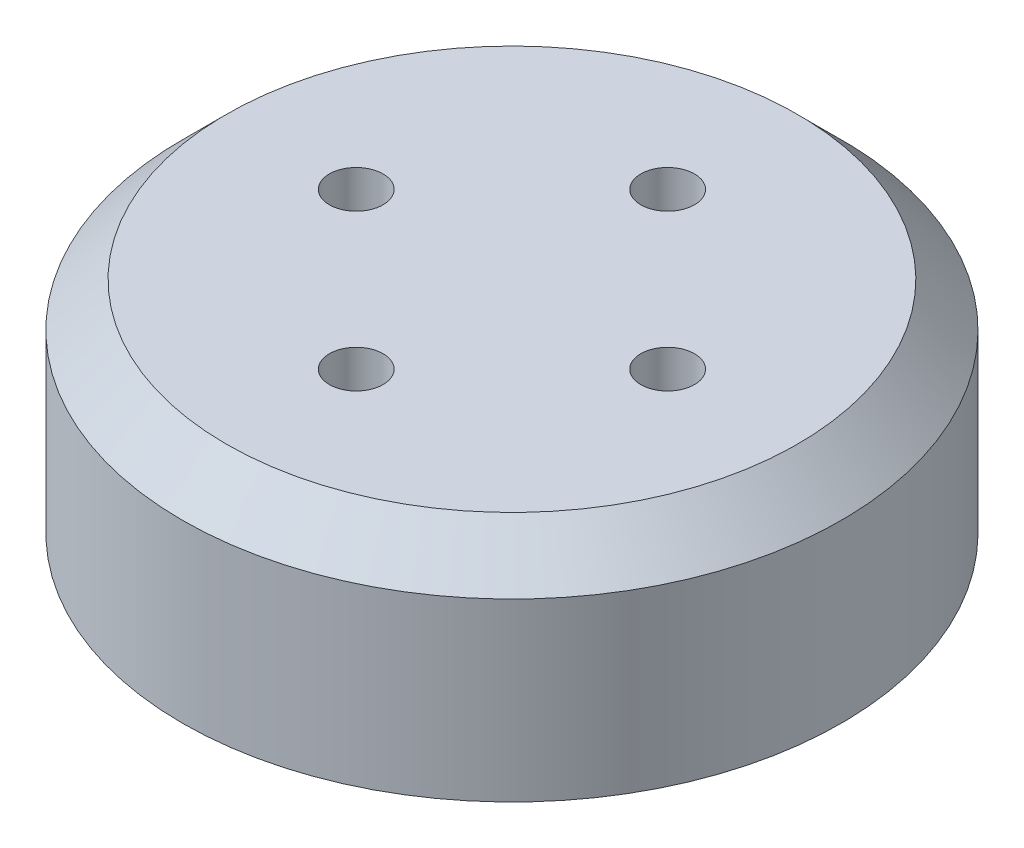
from build123d import *

# Parameters (mm, degrees)
SKETCH2_R           = 1.55
CUT_EXTRUDE1_DEPTH  = 33.995567884
SKETCH3_R           = 1.45
BOSS_EXTRUDE1_DEPTH = 1.27
CHAMFER1_SIZE       = 2.54


with BuildPart() as part:
    # Sketch1 → Revolve1 (revolve)
    with BuildSketch(Plane(origin=(0, 0, 0), x_dir=(0, 0, -1), z_dir=(1, 0, 0))):
        Polygon((0, 0), (0, -6.35), (-4.975, -6.35), (-4.975, 0), (-19.05, 0), (-19.05, 12.7), (0, 12.7), align=None)
    revolve(axis=Axis((0, 12.7, 0), (0, -1, 0)))

    # Sketch2 → Cut-Extrude1 (cut, through all)
    with BuildSketch(Plane(origin=(0, 12.7, 0), x_dir=(1, 0, 0), z_dir=(0, 1, 0))):
        with Locations(Location((0, 9, 0), (0, 0, 270))):
            Circle(SKETCH2_R)
        with Locations(Location((0, -9, 0), (0, 0, 270))):
            Circle(SKETCH2_R)
        with Locations(Location((9, 0, 0), (0, 0, 270))):
            Circle(SKETCH2_R)
        with Locations(Location((-9, 0, 0), (0, 0, 270))):
            Circle(SKETCH2_R)
    extrude(amount=-CUT_EXTRUDE1_DEPTH, mode=Mode.SUBTRACT)

    # Sketch3 → Boss-Extrude1 (add)
    with BuildSketch(Plane.XZ):
        with Locations(Location((-5.08, -5.08, 0), (0, 0, 270))):
            Circle(SKETCH3_R)
        with Locations(Location((-5.08, 5.08, 0), (0, 0, 270))):
            Circle(SKETCH3_R)
        with Locations(Location((5.08, 5.08, 0), (0, 0, 270))):
            Circle(SKETCH3_R)
        with Locations(Location((5.08, -5.08, 0), (0, 0, 270))):
            Circle(SKETCH3_R)
    extrude(amount=BOSS_EXTRUDE1_DEPTH)

    # Chamfer1
    chamfer1_edges = [part.edges().sort_by_distance(p)[0] for p in [
        (0, 12.7, -19.05),
    ]]
    chamfer(chamfer1_edges, length=CHAMFER1_SIZE)


solid = part.part
